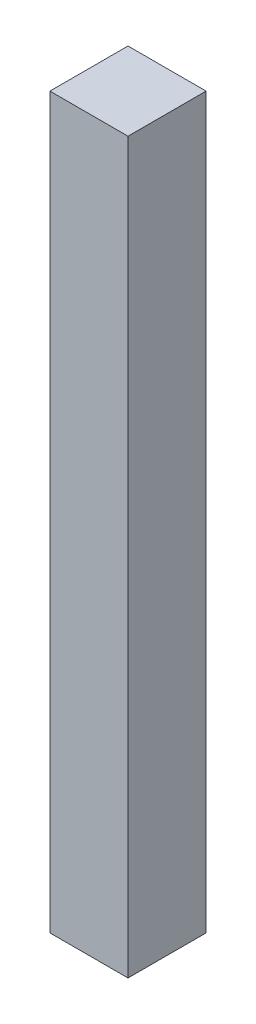
from build123d import *

# Parameters (mm, degrees)
SKETCH_1_W      = 30
SKETCH_1_H      = 30
EXTRUDE_1_DEPTH = 280


with BuildPart() as part:
    # 草图1 → 凸台-拉伸1 (new body)
    with BuildSketch(Plane(origin=(0, 0, 0), x_dir=(1, 0, 0), z_dir=(0, 1, 0))):
        Rectangle(SKETCH_1_W, SKETCH_1_H)
    extrude(amount=EXTRUDE_1_DEPTH)


solid = part.part
